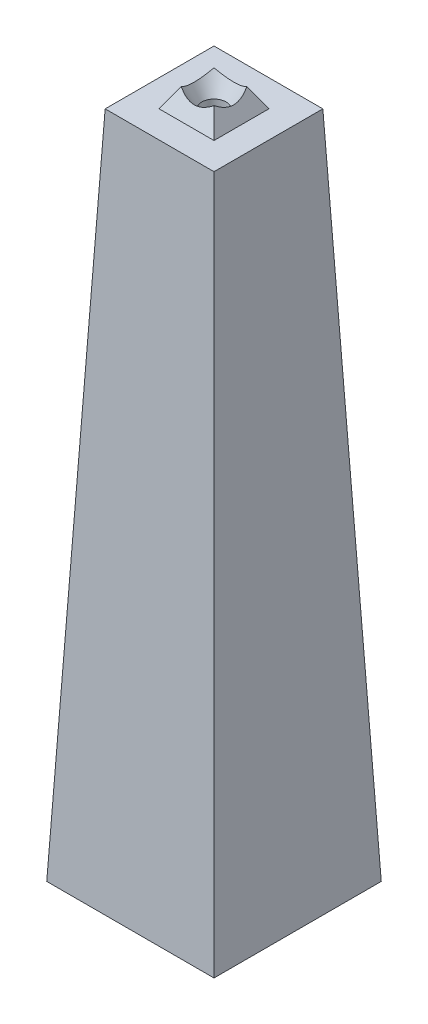
from build123d import *

# Parameters (mm, degrees)
SKETCH1_W           = 47.625
SKETCH1_H           = 47.625
BOSS_EXTRUDE1_DEPTH = 381
BOSS_EXTRUDE1_TAPER = 2.5
SKETCH2_R           = 3.429
CUT_EXTRUDE1_DEPTH  = 381
SKETCH5_W           = 47.625
SKETCH5_H           = 47.625
CUT_EXTRUDE4_DEPTH  = 190.5
SKETCH6_W           = 15.621
SKETCH6_H           = 15.621
SKETCH6_R           = 3.429
BOSS_EXTRUDE2_DEPTH = 6.35
BOSS_EXTRUDE2_TAPER = 30


with BuildPart() as part:
    # Sketch1 → Boss-Extrude1 (new body)
    with BuildSketch(Plane(origin=(0, 0, 0), x_dir=(1, 0, 0), z_dir=(0, 1, 0))):
        with Locations((23.8125, -23.8125)):
            Rectangle(SKETCH1_W, SKETCH1_H)
    extrude(amount=BOSS_EXTRUDE1_DEPTH, taper=BOSS_EXTRUDE1_TAPER)

    # Sketch2 → Cut-Extrude1 (cut)
    with BuildSketch(Plane.XZ):
        with Locations(Location((23.8125, 23.8125, 0), (0, 0, 270))):
            Circle(SKETCH2_R)
    extrude(amount=-CUT_EXTRUDE1_DEPTH, mode=Mode.SUBTRACT)

    # Sketch5 → Cut-Extrude4 (cut)
    with BuildSketch(Plane(origin=(0, 381, 0), x_dir=(1, 0, 0), z_dir=(0, 1, 0))):
        with Locations((23.8125, -23.8125)):
            Rectangle(SKETCH5_W, SKETCH5_H)
    extrude(amount=-CUT_EXTRUDE4_DEPTH, mode=Mode.SUBTRACT)

    # Sketch6 → Boss-Extrude2 (add)
    with BuildSketch(Plane(origin=(0, 190.5, 0), x_dir=(1, 0, 0), z_dir=(0, 1, 0))):
        with Locations((23.8125, -23.8125)):
            Rectangle(SKETCH6_W, SKETCH6_H)
        with Locations(Location((23.8125, -23.8125, 0), (0, 0, 90))):
            Circle(SKETCH6_R, mode=Mode.SUBTRACT)
    extrude(amount=BOSS_EXTRUDE2_DEPTH, taper=BOSS_EXTRUDE2_TAPER)


solid = part.part
